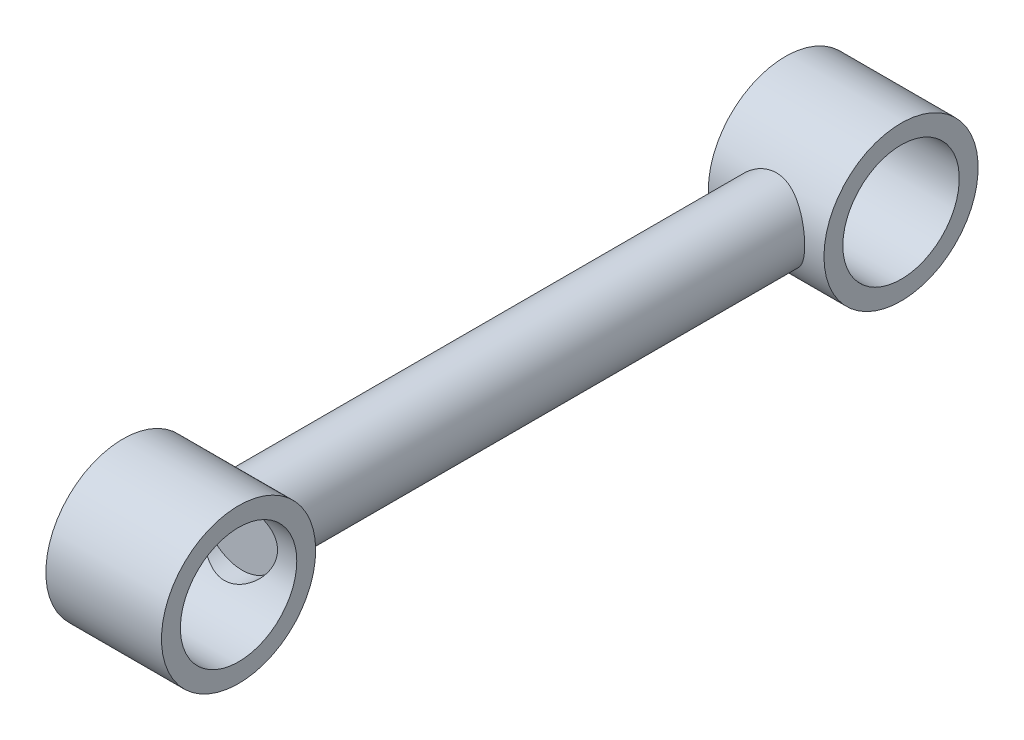
from build123d import *

# Parameters (mm, degrees)
SKETCH4_R           = 25.4
SKETCH4_R_2         = 19.177
BOSS_EXTRUDE3_DEPTH = 19.05
SKETCH6_R           = 12.7
BOSS_EXTRUDE4_DEPTH = 203.2
CUT_EXTRUDE2_START  = -12.7
SKETCH8_R           = 12.7
CUT_EXTRUDE2_DEPTH  = 12.7
SKETCH9_R           = 12.7
CUT_EXTRUDE4_DEPTH  = 12.7


with BuildPart() as part:
    # Sketch4 → Boss-Extrude3 (new, symmetric)
    with BuildSketch(Plane(origin=(0, 0, 0), x_dir=(0, 0, -1), z_dir=(1, 0, 0))):
        with Locations(Location((-284.396079729, 0, 0), (0, 0, 180))):
            Circle(SKETCH4_R)
        with Locations(Location((-284.396079729, 0, 0), (0, 0, 180))):
            Circle(SKETCH4_R_2, mode=Mode.SUBTRACT)
    boss_extrude3 = extrude(amount=BOSS_EXTRUDE3_DEPTH, both=True)

    # Sketch6 → Boss-Extrude4 (add)
    with BuildSketch(Plane.XY.offset(276.86)):
        Circle(SKETCH6_R)
    extrude(amount=-BOSS_EXTRUDE4_DEPTH)

    # Mirror1: Boss-Extrude3 across plane
    add(boss_extrude3.mirror(Plane(origin=(0, 0, 175.26), x_dir=(1, 0, 0), z_dir=(0, 0, -1))))

    # Sketch8 → Cut-Extrude2 (cut)
    with BuildSketch(Plane(origin=(0, 0, 73.66), x_dir=(-1, 0, 0), z_dir=(0, 0, -1)).offset(CUT_EXTRUDE2_START)):
        with Locations(Location((0, 0, 0), (0, 0, 180))):
            Circle(SKETCH8_R)
    extrude(amount=CUT_EXTRUDE2_DEPTH, mode=Mode.SUBTRACT)

    # Sketch9 → Cut-Extrude4 (cut)
    with BuildSketch(Plane.XY.offset(276.86)):
        Circle(SKETCH9_R)
    extrude(amount=-CUT_EXTRUDE4_DEPTH, mode=Mode.SUBTRACT)


solid = part.part
